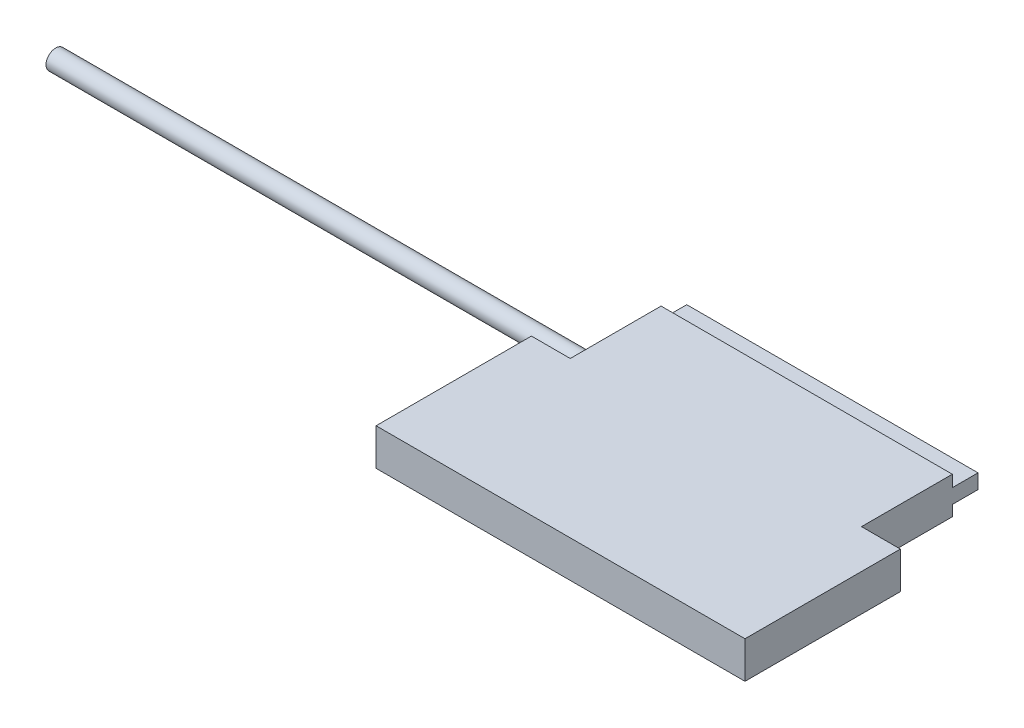
from build123d import *

# Parameters (mm, degrees)
AUFSATZ_LINEAR_AUSTRAGEN1_DEPTH = 1.9
SKIZZE4_R                       = 0.5
AUFSATZ_LINEAR_AUSTRAGEN3_DEPTH = 28
SKIZZE5_W                       = 1.322669318
SKIZZE5_H                       = 0.6
SKIZZE5_H_2                     = 0.55
SCHNITT_LINEAR_AUSTRAGEN1_DEPTH = 16


with BuildPart() as part:
    # Skizze1 → Aufsatz-Linear austragen1 (new body)
    with BuildSketch(Plane(origin=(0, 0, 0), x_dir=(1, 0, 0), z_dir=(0, 1, 0))):
        Polygon((0, 0), (19, 0), (19, 8), (17, 8), (17, 14), (2, 14), (2, 8), (0, 8), align=None)
    extrude(amount=AUFSATZ_LINEAR_AUSTRAGEN1_DEPTH)

    # Skizze4 → Aufsatz-Linear austragen3 (add)
    with BuildSketch(Plane.ZY.offset(-2)):
        with Locations(Location((-9.5, 0.5, 0), (0, 0, 270))):
            Circle(SKIZZE4_R)
    extrude(amount=AUFSATZ_LINEAR_AUSTRAGEN3_DEPTH)

    # Skizze5 → Schnitt-Linear austragen1 (cut)
    with BuildSketch(Plane(origin=(17, 0, 0), x_dir=(0, 0, -1), z_dir=(1, 0, 0))):
        with Locations((13.338665341, 1.6)):
            Rectangle(SKIZZE5_W, SKIZZE5_H)
        with Locations((13.338665341, 0.275)):
            Rectangle(SKIZZE5_W, SKIZZE5_H_2)
    extrude(amount=-SCHNITT_LINEAR_AUSTRAGEN1_DEPTH, mode=Mode.SUBTRACT)


solid = part.part
